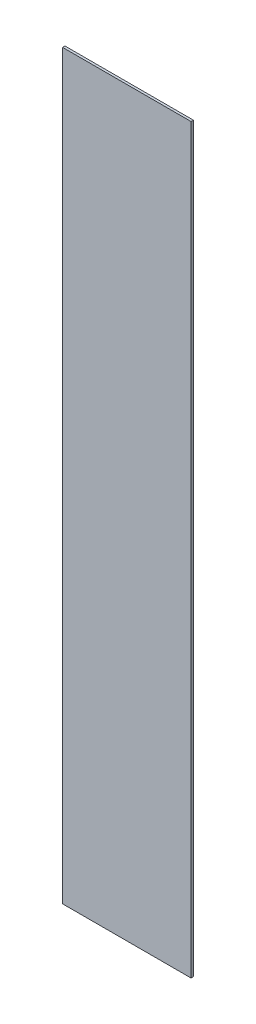
from build123d import *

# Parameters (mm, degrees)
SKETCH1_W           = 270
SKETCH1_H           = 1560
PLATE_EXTRUDE_DEPTH = 5


with BuildPart() as part:
    # Sketch1 → Plate extrude (new body)
    with BuildSketch(Plane.XY):
        Rectangle(SKETCH1_W, SKETCH1_H)
    extrude(amount=PLATE_EXTRUDE_DEPTH)


solid = part.part
